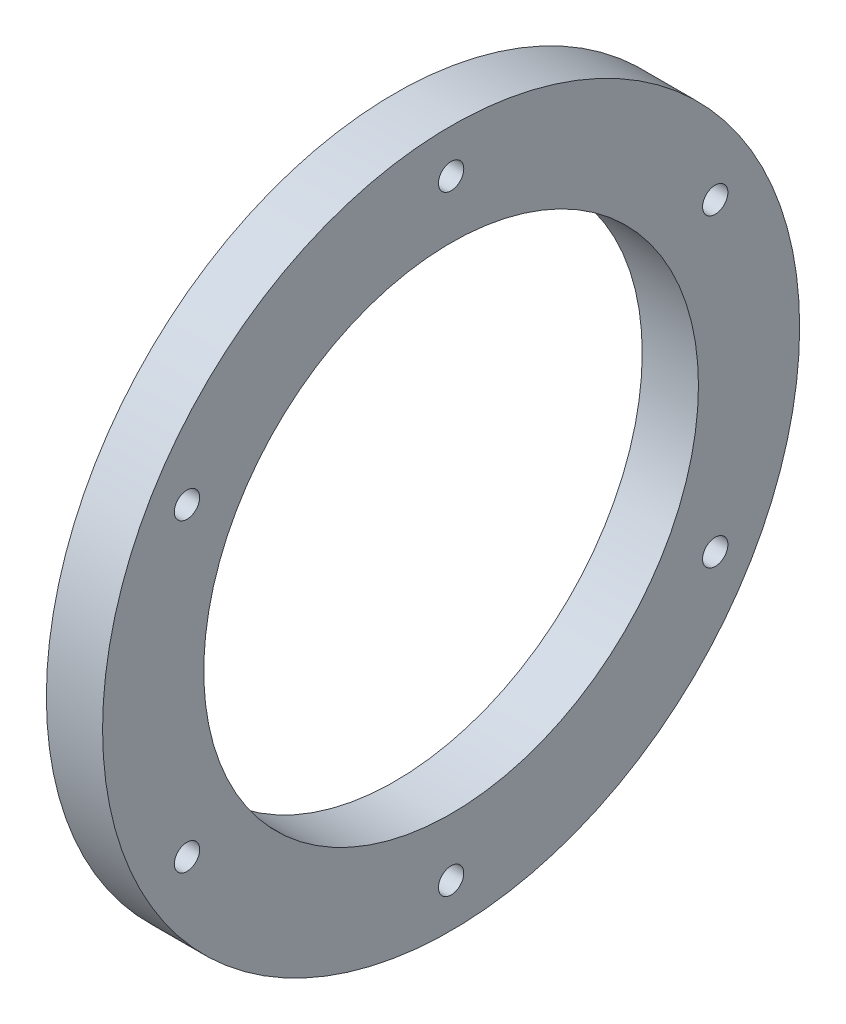
from build123d import *

# Parameters (mm, degrees)
SKETCH_1_R                = 62
SKETCH_1_R_2              = 44
EXTRUDE_373_DEPTH         = 5
PATTERN_CIRCULAR_M4_COUNT = 6


with BuildPart() as part:
    # ｽｹｯﾁ1 → Extrude 373 (new, symmetric)
    with BuildSketch(Plane(origin=(0, 0, 0), x_dir=(0, 0, -1), z_dir=(1, 0, 0))):
        Circle(SKETCH_1_R)
        Circle(SKETCH_1_R_2, mode=Mode.SUBTRACT)
    extrude(amount=EXTRUDE_373_DEPTH, both=True)

    # ｽｹｯﾁ2 → M4 通し穴 (revolve, cut)
    with BuildSketch(Plane(origin=(5, 54.25, 0), x_dir=(0, 0, -1), z_dir=(0, 1, 0))):
        Polygon((0, 0), (0, 11.351936393), (2.25, 10), (2.25, 0), align=None)
    hole_wizard_m4 = revolve(axis=Axis((11.35, 54.25, 0), (-1, 0, 0)), mode=Mode.SUBTRACT)

    # M4 通し穴 等配: M4 通し穴 ×6 about axis
    pattern_circular_m4_axis = Axis((-5.5, 0, 0), (1, 0, 0))
    for i in range(1, PATTERN_CIRCULAR_M4_COUNT):
        add(hole_wizard_m4.rotate(pattern_circular_m4_axis, i * 360 / PATTERN_CIRCULAR_M4_COUNT), mode=Mode.SUBTRACT)


solid = part.part
